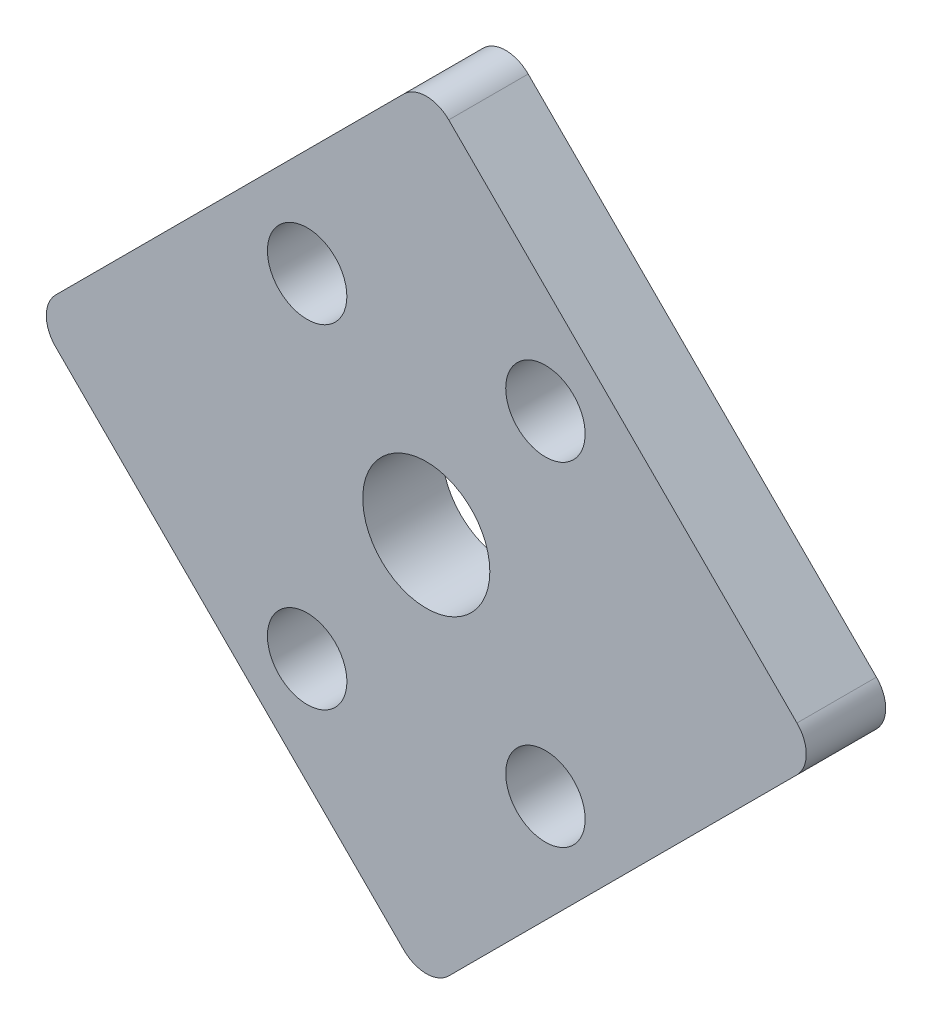
from build123d import *

# Parameters (mm, degrees)
EXTRUDE_1_DEPTH     = 5
SKETCH_2_R          = 4
CUT_EXTRUDE_1_DEPTH = 5
SKETCH_5_R          = 2.5
CUT_EXTRUDE_2_DEPTH = 36.355339059
FILLET_1_R          = 2


with BuildPart() as part:
    # 草图1 → 凸台-拉伸1 (new body)
    with BuildSketch(Plane.XY):
        Polygon((0, -24.748737342), (24.748737342, 0), (0, 24.748737342), (-24.748737342, 0), align=None)
    extrude(amount=EXTRUDE_1_DEPTH)

    # 草图2 → 切除-拉伸1 (cut)
    with BuildSketch(Plane.XY.offset(5)):
        Circle(SKETCH_2_R)
    extrude(amount=-CUT_EXTRUDE_1_DEPTH, mode=Mode.SUBTRACT)

    # 草图5 → 切除-拉伸2 (cut, through all)
    with BuildSketch(Plane.XY.offset(5)):
        with Locations((-7.5, 10.5)):
            Circle(SKETCH_5_R)
        with Locations(Location((7.5, 10.5, 0), (0, 0, 180))):
            Circle(SKETCH_5_R)
        with Locations((7.5, -10.5)):
            Circle(SKETCH_5_R)
        with Locations(Location((-7.5, -10.5, 0), (0, 0, 180))):
            Circle(SKETCH_5_R)
    extrude(amount=-CUT_EXTRUDE_2_DEPTH, mode=Mode.SUBTRACT)

    # 圆角1
    fillet_1_edges = [part.edges().sort_by_distance(p)[0] for p in [
        (-24.748737342, 0, 2.5),
        (0, 24.748737342, 2.5),
        (24.748737342, 0, 2.5),
        (0, -24.748737342, 2.5),
    ]]
    fillet(fillet_1_edges, radius=FILLET_1_R)


solid = part.part
